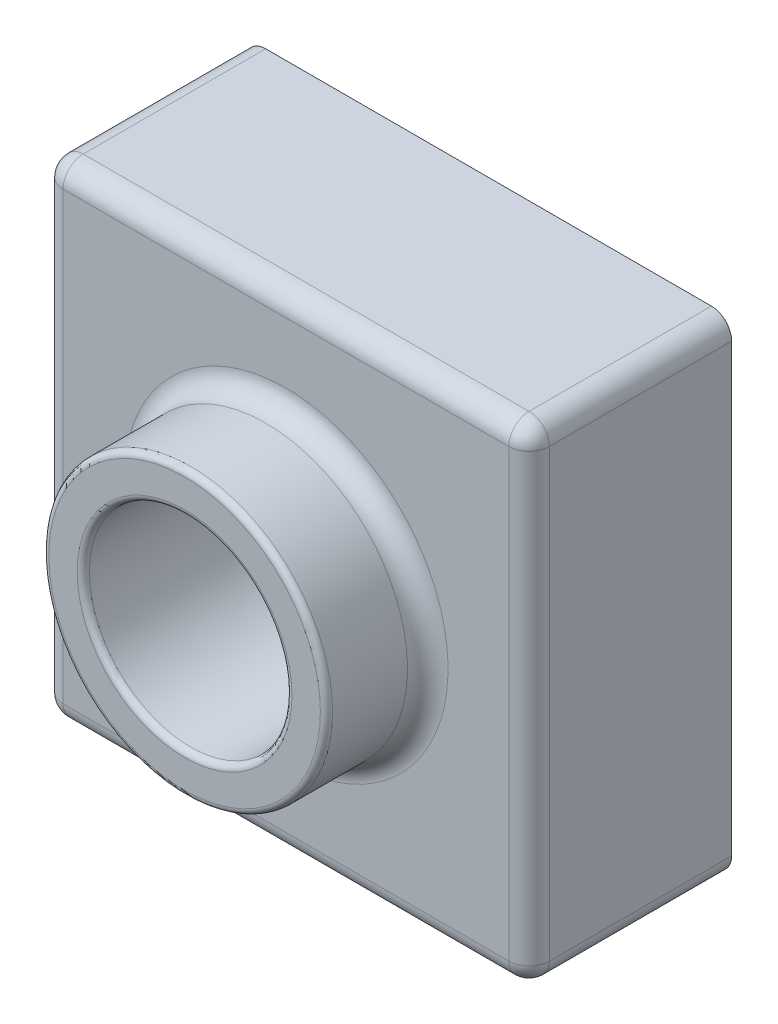
from build123d import *

# Parameters (mm, degrees)
SKETCH1_W           = 120
SKETCH1_H           = 120
BOSS_EXTRUDE1_DEPTH = 50
SKETCH2_R           = 35
BOSS_EXTRUDE2_DEPTH = 25
SKETCH3_R           = 25
CUT_EXTRUDE1_DEPTH  = 186.539753153
FILLET1_R           = 5
FILLET2_R           = 1.5


with BuildPart() as part:
    # Sketch1 → Boss-Extrude1 (new body)
    with BuildSketch(Plane.XY):
        with Locations((60, 60)):
            Rectangle(SKETCH1_W, SKETCH1_H)
    extrude(amount=BOSS_EXTRUDE1_DEPTH)

    # Sketch2 → Boss-Extrude2 (add)
    with BuildSketch(Plane.XY.offset(50)):
        with Locations(Location((60, 60, 0), (0, 0, 180))):
            Circle(SKETCH2_R)
    extrude(amount=BOSS_EXTRUDE2_DEPTH)

    # Sketch3 → Cut-Extrude1 (cut, through all)
    with BuildSketch(Plane.XY.offset(75)):
        with Locations((60, 60)):
            Circle(SKETCH3_R)
    extrude(amount=-CUT_EXTRUDE1_DEPTH, mode=Mode.SUBTRACT)

    # Fillet1
    fillet1_edges = [part.edges().sort_by_distance(p)[0] for p in [
        (120, 60, 50),
        (60, 120, 50),
        (95, 60, 50),
        (0, 60, 50),
        (60, 0, 50),
        (0, 120, 25),
        (120, 120, 25),
        (120, 0, 25),
        (0, 0, 25),
    ]]
    fillet(fillet1_edges, radius=FILLET1_R)

    # Fillet2
    fillet2_edges = [part.edges().sort_by_distance(p)[0] for p in [
        (95, 60, 75),
        (35, 60, 75),
    ]]
    fillet(fillet2_edges, radius=FILLET2_R)


solid = part.part
